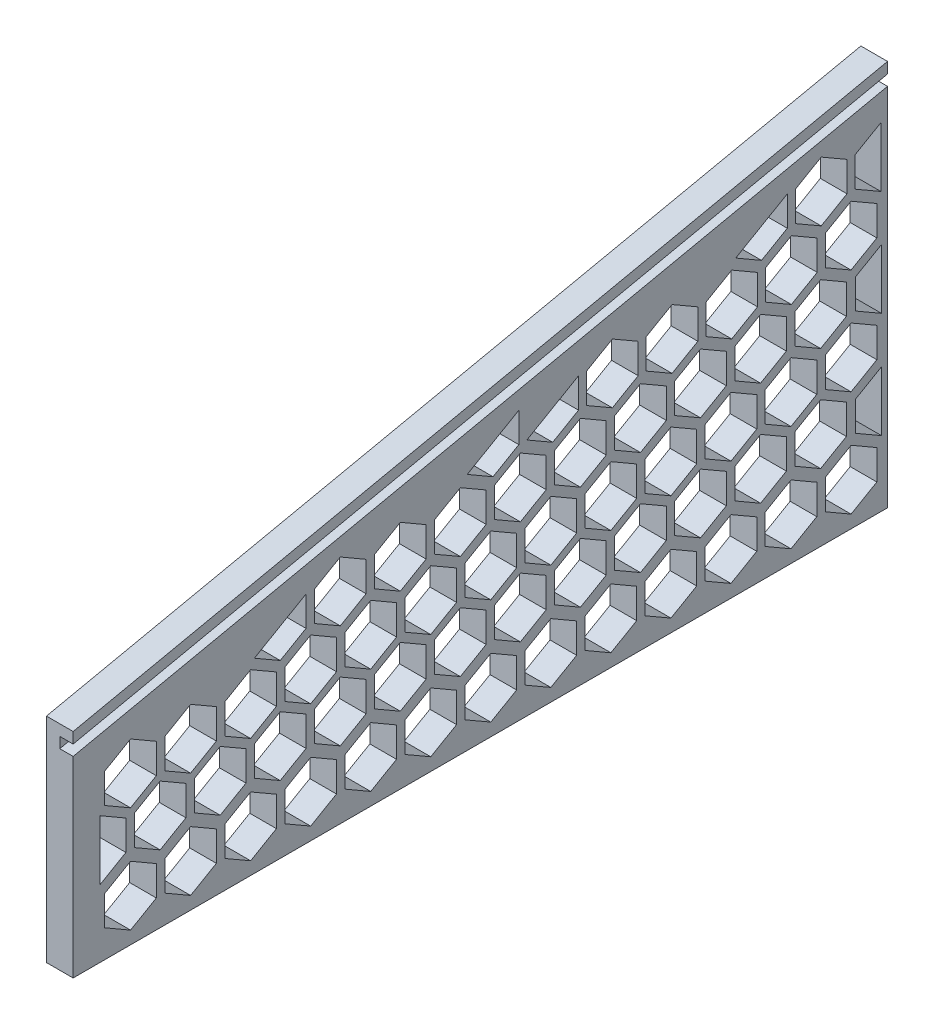
from build123d import *

# Parameters (mm, degrees)
BOSS_EXTRUDE1_DEPTH = 5
CUT_EXTRUDE1_DEPTH  = 10
SKETCH4_W           = 152.591025714
SKETCH4_H           = 40
BOSS_EXTRUDE3_DEPTH = 5
CUT_EXTRUDE3_DEPTH  = 5
CUT_EXTRUDE4_DEPTH  = 2.5


with BuildPart() as part:
    # Sketch1 → Boss-Extrude1 (new body)
    with BuildSketch(Plane(origin=(0, 0, 0), x_dir=(0, 0, -1), z_dir=(1, 0, 0))):
        Polygon((152.591025714, 32.434223768), (0, 0), (152.591025714, 0), align=None)
    extrude(amount=BOSS_EXTRUDE1_DEPTH)

    # Sketch2 → Cut-Extrude1 (cut)
    with BuildSketch(Plane(origin=(5, 0, 0), x_dir=(0, 0, -1), z_dir=(1, 0, 0))):
        Polygon((151.341025714, 11.955858852), (151.341025714, 23.12302347), (146.505501591, 20.331232316), (146.505501591, 14.747650007), align=None)
        Polygon((73.839977467, 4.791791155), (83.511025714, 10.375373464), (83.511025714, 4.791791155), (78.675501591, 2), align=None)
        Polygon((133.816549838, 20.331232316), (124.145501591, 14.747650007), (128.981025714, 11.955858852), (133.816549838, 14.747650007), align=None)
        Polygon((94.691025714, 10.375373464), (85.019977467, 4.791791155), (89.855501591, 2), (94.691025714, 4.791791155), align=None)
        Polygon((145.755501591, 13.167164618), (140.919977467, 10.375373464), (140.919977467, 4.791791155), (145.755501591, 2), (150.591025714, 4.791791155), (150.591025714, 10.375373464), align=None)
        Polygon((134.575501591, 13.167164618), (129.739977467, 10.375373464), (129.739977467, 4.791791155), (134.575501591, 2), (139.411025714, 4.791791155), (139.411025714, 10.375373464), align=None)
        Polygon((140.161025714, 11.955858852), (135.325501591, 14.747650007), (135.325501591, 20.331232316), (140.161025714, 23.12302347), (144.996549838, 20.331232316), (144.996549838, 14.747650007), align=None)
        Polygon((123.395501591, 13.167164618), (118.559977467, 10.375373464), (118.559977467, 4.791791155), (123.395501591, 2), (128.231025714, 4.791791155), (128.231025714, 10.375373464), align=None)
        Polygon((112.215501591, 13.167164618), (107.379977467, 10.375373464), (107.379977467, 4.791791155), (112.215501591, 2), (117.051025714, 4.791791155), (117.051025714, 10.375373464), align=None)
        Polygon((101.035501591, 13.167164618), (96.199977467, 10.375373464), (96.199977467, 4.791791155), (101.035501591, 2), (105.871025714, 4.791791155), (105.871025714, 10.375373464), align=None)
    extrude(amount=-CUT_EXTRUDE1_DEPTH, mode=Mode.SUBTRACT)

    # Sketch4 → Boss-Extrude3 (add)
    with BuildSketch(Plane.ZY):
        with Locations((-76.295512857, -20)):
            Rectangle(SKETCH4_W, SKETCH4_H)
    extrude(amount=-BOSS_EXTRUDE3_DEPTH)

    # Sketch6 → Cut-Extrude3 (cut)
    with BuildSketch(Plane(origin=(5, 0, 0), x_dir=(0, 0, -1), z_dir=(1, 0, 0))):
        Polygon((140.049977467, -16.195093048), (144.885501591, -18.986884203), (144.885501591, -24.570466512), (140.049977467, -27.362257666), (135.214453343, -24.570466512), (135.214453343, -18.986884203), align=None)
        Polygon((145.755501591, -6.597350714), (150.591025714, -9.389141869), (150.591025714, -14.972724178), (145.755501591, -17.764515332), (140.919977467, -14.972724178), (140.919977467, -9.389141869), align=None)
        Polygon((150.591025714, 4.791791155), (150.591025714, 10.375373464), (145.755501591, 13.167164618), (140.919977467, 10.375373464), (140.919977467, 4.791791155), (145.755501591, 2), align=None)
        Polygon((140.049977467, 3.284906952), (144.885501591, 0.493115797), (144.885501591, -5.090466512), (140.049977467, -7.882257666), (135.214453343, -5.090466512), (135.214453343, 0.493115797), align=None)
        Polygon((146.625501591, -5.090466512), (151.461025714, -7.882257666), (151.461025714, 3.284906952), (146.625501591, 0.493115797), align=None)
        Polygon((145.755501591, -26.437350714), (150.591025714, -29.229141869), (150.591025714, -34.812724178), (145.755501591, -37.604515332), (140.919977467, -34.812724178), (140.919977467, -29.229141869), align=None)
        Polygon((134.505501591, -26.437350714), (139.341025714, -29.229141869), (139.341025714, -34.812724178), (134.505501591, -37.604515332), (129.669977467, -34.812724178), (129.669977467, -29.229141869), align=None)
        Polygon((128.799977467, -16.195093048), (133.635501591, -18.986884203), (133.635501591, -24.570466512), (128.799977467, -27.362257666), (123.964453343, -24.570466512), (123.964453343, -18.986884203), align=None)
        Polygon((134.505501591, -6.597350714), (139.341025714, -9.389141869), (139.341025714, -14.972724178), (134.505501591, -17.764515332), (129.669977467, -14.972724178), (129.669977467, -9.389141869), align=None)
        Polygon((128.799977467, 3.284906952), (133.635501591, 0.493115797), (133.635501591, -5.090466512), (128.799977467, -7.882257666), (123.964453343, -5.090466512), (123.964453343, 0.493115797), align=None)
        Polygon((123.255501591, -26.437350714), (128.091025714, -29.229141869), (128.091025714, -34.812724178), (123.255501591, -37.604515332), (118.419977467, -34.812724178), (118.419977467, -29.229141869), align=None)
        Polygon((117.549977467, -16.195093048), (122.385501591, -18.986884203), (122.385501591, -24.570466512), (117.549977467, -27.362257666), (112.714453343, -24.570466512), (112.714453343, -18.986884203), align=None)
        Polygon((123.255501591, -6.597350714), (128.091025714, -9.389141869), (128.091025714, -14.972724178), (123.255501591, -17.764515332), (118.419977467, -14.972724178), (118.419977467, -9.389141869), align=None)
        Polygon((117.549977467, 3.284906952), (122.385501591, 0.493115797), (122.385501591, -5.090466512), (117.549977467, -7.882257666), (112.714453343, -5.090466512), (112.714453343, 0.493115797), align=None)
        Polygon((112.005501591, -26.437350714), (116.841025714, -29.229141869), (116.841025714, -34.812724178), (112.005501591, -37.604515332), (107.169977467, -34.812724178), (107.169977467, -29.229141869), align=None)
        Polygon((106.299977467, -16.195093048), (111.135501591, -18.986884203), (111.135501591, -24.570466512), (106.299977467, -27.362257666), (101.464453343, -24.570466512), (101.464453343, -18.986884203), align=None)
        Polygon((112.005501591, -6.597350714), (116.841025714, -9.389141869), (116.841025714, -14.972724178), (112.005501591, -17.764515332), (107.169977467, -14.972724178), (107.169977467, -9.389141869), align=None)
        Polygon((106.299977467, 3.284906952), (111.135501591, 0.493115797), (111.135501591, -5.090466512), (106.299977467, -7.882257666), (101.464453343, -5.090466512), (101.464453343, 0.493115797), align=None)
        Polygon((100.755501591, -26.437350714), (105.591025714, -29.229141869), (105.591025714, -34.812724178), (100.755501591, -37.604515332), (95.919977467, -34.812724178), (95.919977467, -29.229141869), align=None)
        Polygon((95.049977467, -16.195093048), (99.885501591, -18.986884203), (99.885501591, -24.570466512), (95.049977467, -27.362257666), (90.214453343, -24.570466512), (90.214453343, -18.986884203), align=None)
        Polygon((100.755501591, -6.597350714), (105.591025714, -9.389141869), (105.591025714, -14.972724178), (100.755501591, -17.764515332), (95.919977467, -14.972724178), (95.919977467, -9.389141869), align=None)
        Polygon((95.049977467, 3.284906952), (99.885501591, 0.493115797), (99.885501591, -5.090466512), (95.049977467, -7.882257666), (90.214453343, -5.090466512), (90.214453343, 0.493115797), align=None)
        Polygon((89.505501591, -26.437350714), (94.341025714, -29.229141869), (94.341025714, -34.812724178), (89.505501591, -37.604515332), (84.669977467, -34.812724178), (84.669977467, -29.229141869), align=None)
        Polygon((83.799977467, -16.195093048), (88.635501591, -18.986884203), (88.635501591, -24.570466512), (83.799977467, -27.362257666), (78.964453343, -24.570466512), (78.964453343, -18.986884203), align=None)
        Polygon((89.505501591, -6.597350714), (94.341025714, -9.389141869), (94.341025714, -14.972724178), (89.505501591, -17.764515332), (84.669977467, -14.972724178), (84.669977467, -9.389141869), align=None)
        Polygon((83.799977467, 3.284906952), (88.635501591, 0.493115797), (88.635501591, -5.090466512), (83.799977467, -7.882257666), (78.964453343, -5.090466512), (78.964453343, 0.493115797), align=None)
        Polygon((78.255501591, -26.437350714), (83.091025714, -29.229141869), (83.091025714, -34.812724178), (78.255501591, -37.604515332), (73.419977467, -34.812724178), (73.419977467, -29.229141869), align=None)
        Polygon((72.549977467, -16.195093048), (77.385501591, -18.986884203), (77.385501591, -24.570466512), (72.549977467, -27.362257666), (67.714453343, -24.570466512), (67.714453343, -18.986884203), align=None)
        Polygon((78.255501591, -6.597350714), (83.091025714, -9.389141869), (83.091025714, -14.972724178), (78.255501591, -17.764515332), (73.419977467, -14.972724178), (73.419977467, -9.389141869), align=None)
        Polygon((72.549977467, 3.284906952), (77.385501591, 0.493115797), (77.385501591, -5.090466512), (72.549977467, -7.882257666), (67.714453343, -5.090466512), (67.714453343, 0.493115797), align=None)
        Polygon((67.005501591, -26.437350714), (71.841025714, -29.229141869), (71.841025714, -34.812724178), (67.005501591, -37.604515332), (62.169977467, -34.812724178), (62.169977467, -29.229141869), align=None)
        Polygon((61.299977467, -16.195093048), (66.135501591, -18.986884203), (66.135501591, -24.570466512), (61.299977467, -27.362257666), (56.464453343, -24.570466512), (56.464453343, -18.986884203), align=None)
        Polygon((67.005501591, -6.597350714), (71.841025714, -9.389141869), (71.841025714, -14.972724178), (67.005501591, -17.764515332), (62.169977467, -14.972724178), (62.169977467, -9.389141869), align=None)
        Polygon((61.299977467, 3.284906952), (66.135501591, 0.493115797), (66.135501591, -5.090466512), (61.299977467, -7.882257666), (56.464453343, -5.090466512), (56.464453343, 0.493115797), align=None)
        Polygon((55.755501591, -26.437350714), (60.591025714, -29.229141869), (60.591025714, -34.812724178), (55.755501591, -37.604515332), (50.919977467, -34.812724178), (50.919977467, -29.229141869), align=None)
        Polygon((50.049977467, -16.195093048), (54.885501591, -18.986884203), (54.885501591, -24.570466512), (50.049977467, -27.362257666), (45.214453343, -24.570466512), (45.214453343, -18.986884203), align=None)
        Polygon((55.755501591, -6.597350714), (60.591025714, -9.389141869), (60.591025714, -14.972724178), (55.755501591, -17.764515332), (50.919977467, -14.972724178), (50.919977467, -9.389141869), align=None)
        Polygon((50.049977467, 3.284906952), (54.885501591, 0.493115797), (54.885501591, -5.090466512), (50.049977467, -7.882257666), (45.214453343, -5.090466512), (45.214453343, 0.493115797), align=None)
        Polygon((44.505501591, -26.437350714), (49.341025714, -29.229141869), (49.341025714, -34.812724178), (44.505501591, -37.604515332), (39.669977467, -34.812724178), (39.669977467, -29.229141869), align=None)
        Polygon((38.799977467, -16.195093048), (43.635501591, -18.986884203), (43.635501591, -24.570466512), (38.799977467, -27.362257666), (33.964453343, -24.570466512), (33.964453343, -18.986884203), align=None)
        Polygon((44.505501591, -6.597350714), (49.341025714, -9.389141869), (49.341025714, -14.972724178), (44.505501591, -17.764515332), (39.669977467, -14.972724178), (39.669977467, -9.389141869), align=None)
        Polygon((43.635501591, 0.493115797), (43.635501591, -5.090466512), (38.799977467, -7.882257666), (33.964453343, -5.090466512), align=None)
        Polygon((33.255501591, -26.437350714), (38.091025714, -29.229141869), (38.091025714, -34.812724178), (33.255501591, -37.604515332), (28.419977467, -34.812724178), (28.419977467, -29.229141869), align=None)
        Polygon((27.549977467, -16.195093048), (32.385501591, -18.986884203), (32.385501591, -24.570466512), (27.549977467, -27.362257666), (22.714453343, -24.570466512), (22.714453343, -18.986884203), align=None)
        Polygon((33.255501591, -6.597350714), (38.091025714, -9.389141869), (38.091025714, -14.972724178), (33.255501591, -17.764515332), (28.419977467, -14.972724178), (28.419977467, -9.389141869), align=None)
        Polygon((22.005501591, -26.437350714), (26.841025714, -29.229141869), (26.841025714, -34.812724178), (22.005501591, -37.604515332), (17.169977467, -34.812724178), (17.169977467, -29.229141869), align=None)
        Polygon((16.299977467, -16.195093048), (21.135501591, -18.986884203), (21.135501591, -24.570466512), (16.299977467, -27.362257666), (11.464453343, -24.570466512), (11.464453343, -18.986884203), align=None)
        Polygon((22.005501591, -6.597350714), (26.841025714, -9.389141869), (26.841025714, -14.972724178), (22.005501591, -17.764515332), (17.169977467, -14.972724178), (17.169977467, -9.389141869), align=None)
        Polygon((10.755501591, -26.437350714), (15.591025714, -29.229141869), (15.591025714, -34.812724178), (10.755501591, -37.604515332), (5.919977467, -34.812724178), (5.919977467, -29.229141869), align=None)
        Polygon((5.049977467, -16.195093048), (9.885501591, -18.986884203), (9.885501591, -24.570466512), (5.049977467, -27.362257666), align=None)
        Polygon((10.755501591, -6.597350714), (15.591025714, -9.389141869), (15.591025714, -14.972724178), (10.755501591, -17.764515332), (5.919977467, -14.972724178), (5.919977467, -9.389141869), align=None)
        Polygon((151.461025714, -16.555093048), (146.625501591, -19.346884203), (146.625501591, -24.930466512), (151.461025714, -27.722257666), align=None)
    extrude(amount=-CUT_EXTRUDE3_DEPTH, mode=Mode.SUBTRACT)

    # Sketch7 → Cut-Extrude4 (cut)
    with BuildSketch(Plane(origin=(5, 0, 0), x_dir=(0, 0, -1), z_dir=(1, 0, 0))):
        Polygon((0, -2.04468119), (152.591025714, 30.389542578), (152.591025714, 28.389542578), (0, -4.04468119), align=None)
    extrude(amount=-CUT_EXTRUDE4_DEPTH, mode=Mode.SUBTRACT)


solid = part.part
